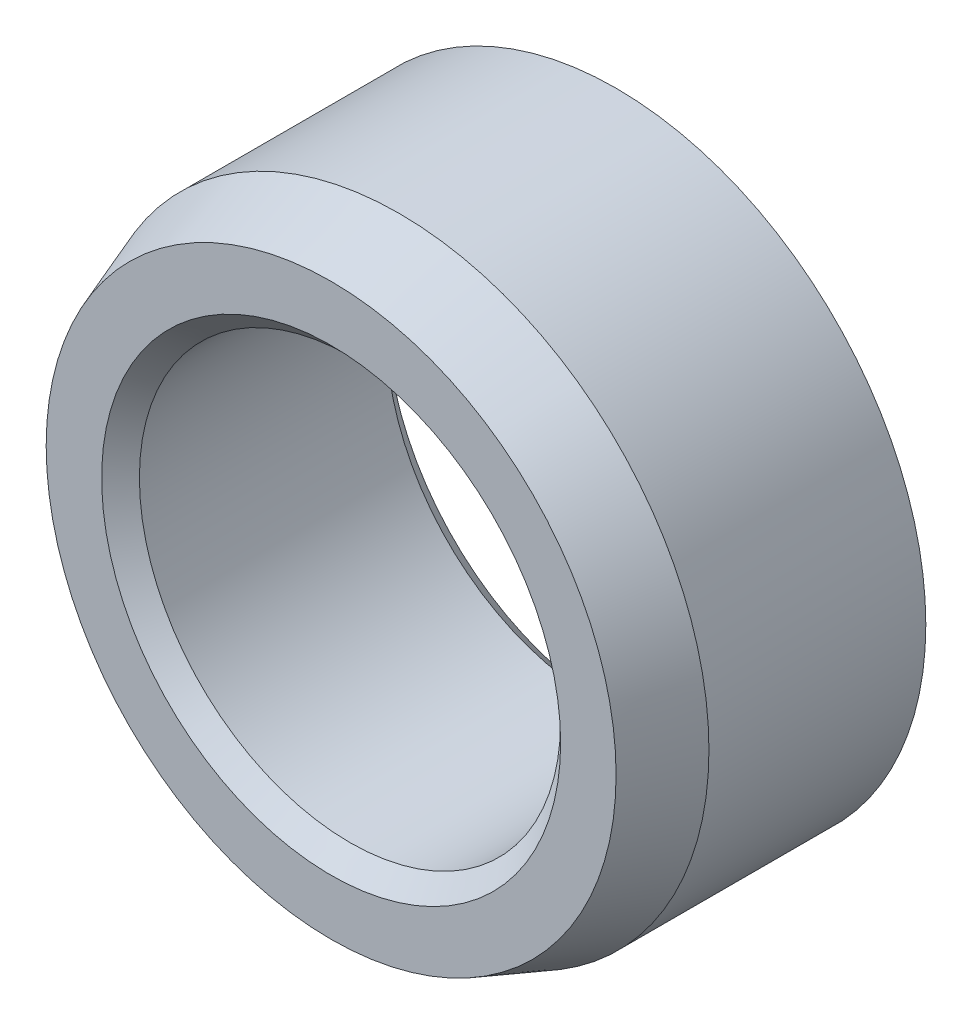
from build123d import *


with BuildPart() as part:
    # Sketch1 → Revolve1 (revolve)
    with BuildSketch(Plane(origin=(0, 0, 0), x_dir=(0, 0, -1), z_dir=(1, 0, 0)), mode=Mode.PRIVATE) as revolve1_sk:
        Polygon((0.762, 8.5), (10.738, 8.5), (11.5, 9.262), (11.5, 12.5), (2.747477419, 12.5), (0, 11.5), (0, 9.262), align=None)
    revolve(revolve1_sk.sketch.rotate(Axis((0, 0, 30.269964388), (0, 0, -1)), 90), axis=Axis((0, 0, 30.269964388), (0, 0, -1)))


solid = part.part
